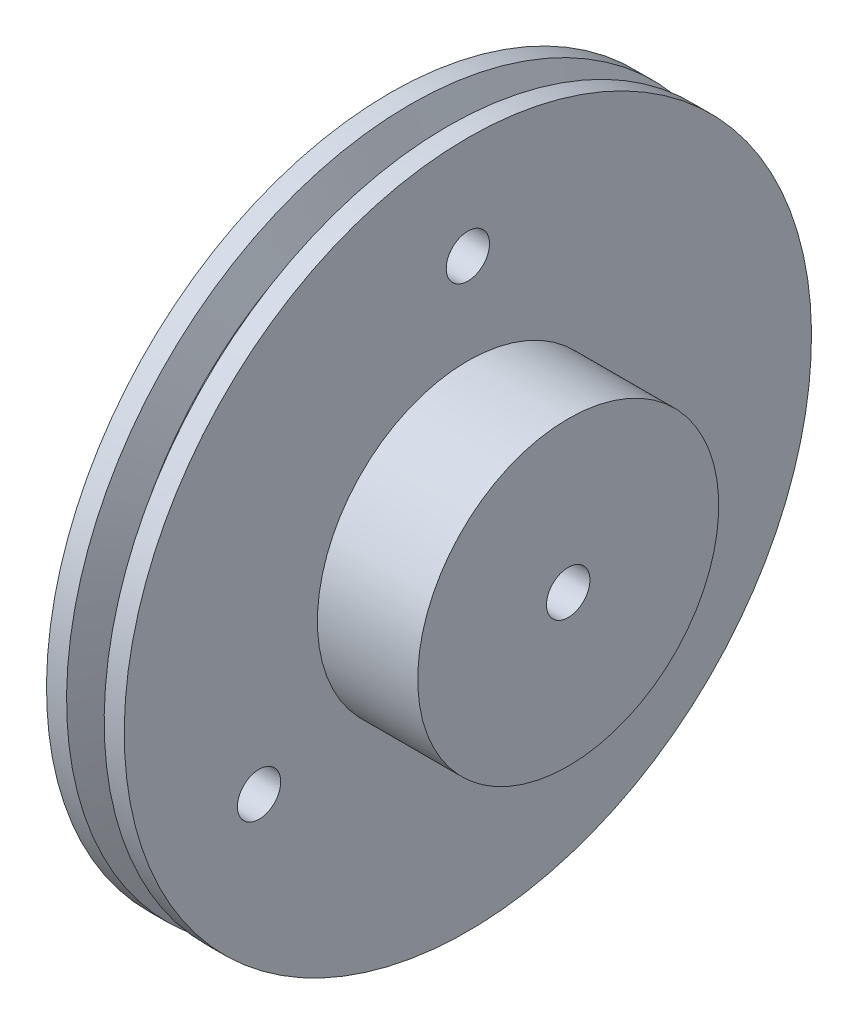
from build123d import *

# Parameters (mm, degrees)
SKETCH3_R          = 5.5
CUT_EXTRUDE1_DEPTH = 132.030215122
SKETCH4_R          = 5.481177192
CUT_EXTRUDE2_DEPTH = 126.624122086


with BuildPart() as part:
    # Sketch2 → Revolve1 (revolve)
    with BuildSketch(Plane.XY):
        Polygon((0, 0), (0, 86.995), (5.08, 86.995), (8.781317037, 79.0575), (10.903682963, 79.0575), (14.605, 86.995), (19.685, 86.995), (19.685, 38.1), (45.085, 38.1), (45.085, 0), align=None)
    revolve(axis=Axis((45.085, 0, 0), (-1, 0, 0)))

    # Sketch3 → Cut-Extrude1 (cut, through all)
    with BuildSketch(Plane(origin=(45.085, 0, 0), x_dir=(0, 0, -1), z_dir=(1, 0, 0))):
        with Locations(Location((0, 0, 0), (0, 0, 90))):
            Circle(SKETCH3_R)
    extrude(amount=-CUT_EXTRUDE1_DEPTH, mode=Mode.SUBTRACT)

    # Sketch4 → Cut-Extrude2 (cut, through all)
    with BuildSketch(Plane(origin=(19.685, 0, 0), x_dir=(0, 0, -1), z_dir=(1, 0, 0))):
        with Locations(Location((0, 61.039888565, 0), (0, 0, 90))):
            Circle(SKETCH4_R)
        with Locations(Location((52.862094142, -30.519944283, 0), (0, 0, 90))):
            Circle(SKETCH4_R)
        with Locations(Location((-52.862094142, -30.519944283, 0), (0, 0, 90))):
            Circle(SKETCH4_R)
    extrude(amount=-CUT_EXTRUDE2_DEPTH, mode=Mode.SUBTRACT)


solid = part.part
